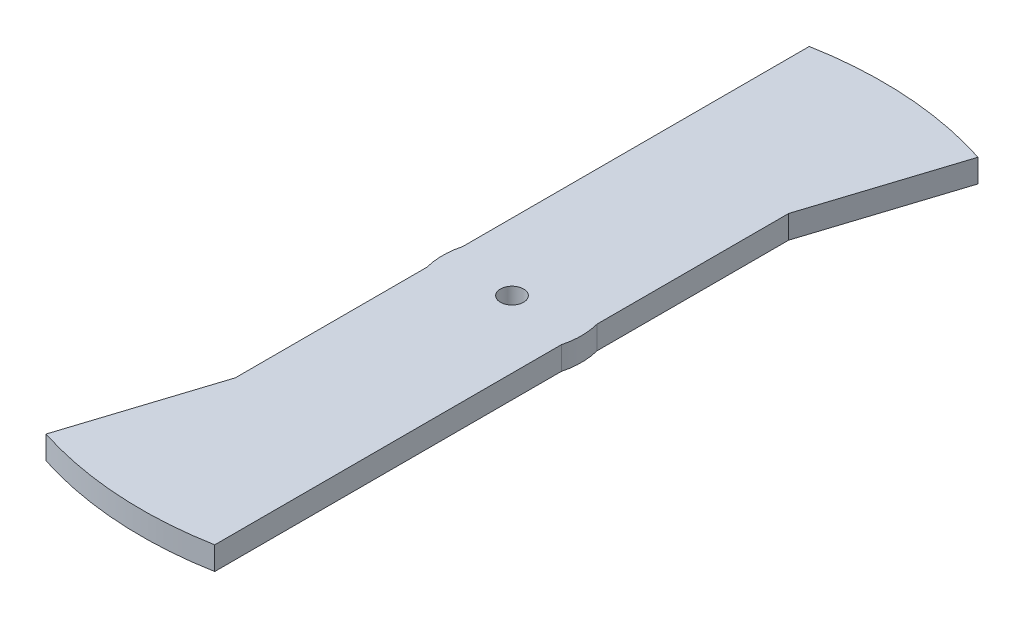
from build123d import *

# Parameters (mm, degrees)
SKETCH1_R           = 3.175
BOSS_EXTRUDE1_DEPTH = 6.35


with BuildPart() as part:
    # Sketch1 → Boss-Extrude1 (new body)
    with BuildSketch(Plane(origin=(0, 0, 0), x_dir=(1, 0, 0), z_dir=(0, 1, 0))):
        with BuildLine():
            ThreePointArc((18.415, 4.87752755), (19.05, 0), (18.415, -4.87752755))
            Line((18.415, -4.87752755), (18.415, -99.9172046))
            ThreePointArc((18.415, -99.9172046), (-6.495802818, -101.392132563), (-31.014736842, -96.750432033))
            Line((-31.014736842, -96.750432033), (-18.415, -57.44556902))
            Line((-18.415, -57.44556902), (-18.415, -4.87752755))
            ThreePointArc((-18.415, -4.87752755), (-19.05, 0), (-18.415, 4.87752755))
            Line((-18.415, 4.87752755), (-18.415, 99.9172046))
            ThreePointArc((-18.415, 99.9172046), (6.495802818, 101.392132563), (31.014736842, 96.750432033))
            Line((31.014736842, 96.750432033), (18.415, 57.44556902))
            Line((18.415, 57.44556902), (18.415, 4.87752755))
        make_face()
        with Locations(Location((0, 0, 0), (0, 0, 270))):
            Circle(SKETCH1_R, mode=Mode.SUBTRACT)
    extrude(amount=BOSS_EXTRUDE1_DEPTH)


solid = part.part
